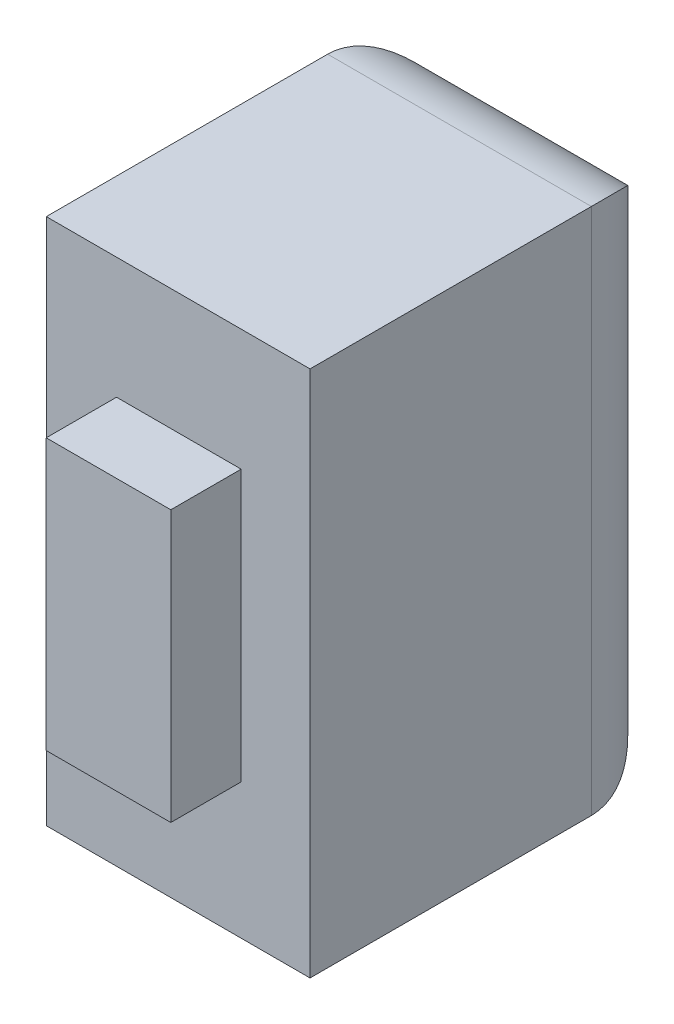
from build123d import *

# Parameters (mm, degrees)
SKETCH_3_W           = 3
SKETCH_3_H           = 6
EXTRUDE_2_DEPTH      = 3.5
SKETCH_4_OUTSIDE_W   = 6.514
SKETCH_4_OUTSIDE_H   = 9.514
SKETCH_4_OUTSIDE_W_2 = 1.417406922
SKETCH_4_OUTSIDE_H_2 = 3.080497711
CUT_EXTRUDE_1_DEPTH  = 0.8
SKETCH_9_W           = 3
SKETCH_9_H           = 6
EXTRUDE_5_DEPTH      = 1.5
FILLET_2_R           = 1


with BuildPart() as part:
    # 草图3 → 凸台-拉伸2 (new body)
    with BuildSketch(Plane.XY):
        with Locations((-0.538539978, -1.817017803)):
            Rectangle(SKETCH_3_W, SKETCH_3_H)
    extrude(amount=EXTRUDE_2_DEPTH)

    # 草图4 outside → 切除-拉伸1 (cut)
    with BuildSketch(Plane.XY.offset(3.5)):
        with Locations((-0.539, -1.817)):
            Rectangle(SKETCH_4_OUTSIDE_W, SKETCH_4_OUTSIDE_H)
        with Locations((-0.530790021, -1.736698078)):
            Rectangle(SKETCH_4_OUTSIDE_W_2, SKETCH_4_OUTSIDE_H_2, mode=Mode.SUBTRACT)
    extrude(amount=-CUT_EXTRUDE_1_DEPTH, mode=Mode.SUBTRACT)

    # 草图9 → 凸台-拉伸5 (add)
    with BuildSketch(Plane(origin=(0, 0, 0), x_dir=(-1, 0, 0), z_dir=(0, 0, -1))):
        with Locations((0.538539978, -1.817017803)):
            Rectangle(SKETCH_9_W, SKETCH_9_H)
    extrude(amount=EXTRUDE_5_DEPTH)

    # 圆角2
    fillet_2_edges = [part.edges().sort_by_distance(p)[0] for p in [
        (0.961460022, -1.817017803, -1.5),
        (-0.538539978, -4.817017803, -1.5),
        (-2.038539978, -1.817017803, -1.5),
        (-0.538539978, 1.182982197, -1.5),
    ]]
    fillet(fillet_2_edges, radius=FILLET_2_R)


solid = part.part
